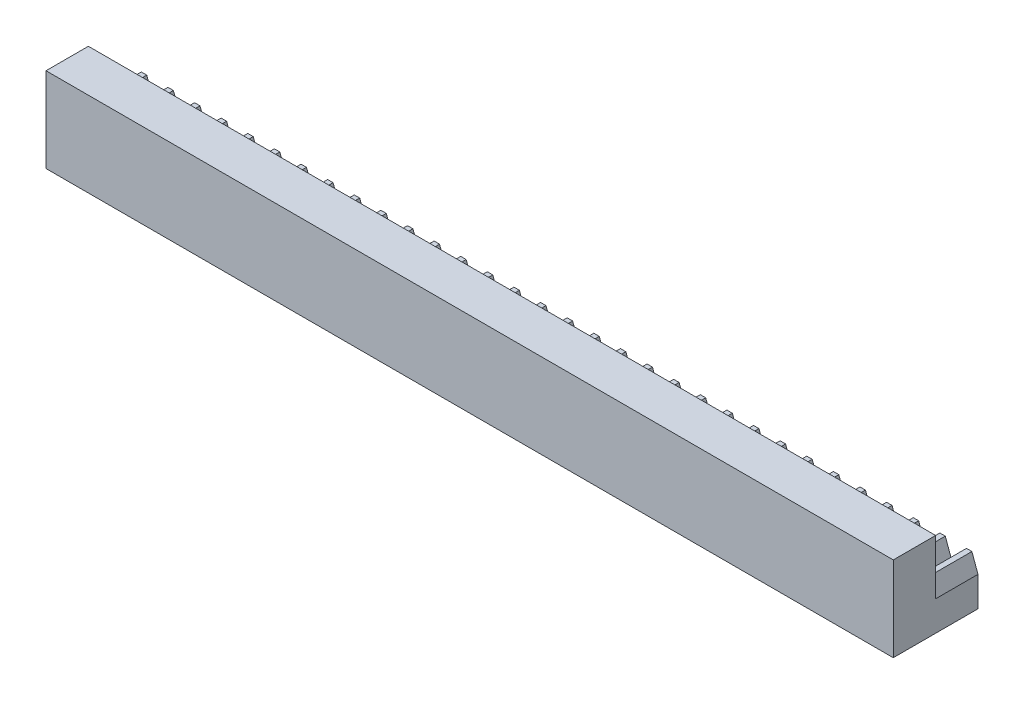
from build123d import *

# Parameters (mm, degrees)
BLANKSKE_W         = 200
BLANKSKE_H         = 11
BLANK_DEPTH        = 10
TOOTHCUTSIM_DEPTH  = 201.55173896
TEETHCUTS_COUNT    = 33
TEETHCUTS_PITCH    = 6.2831853
ESQUISSE2_W        = 200
ESQUISSE2_H        = 20
BOSS_EXTRU_2_DEPTH = 10


with BuildPart() as part:
    # BlankSke → Blank (new body)
    with BuildSketch(Plane.XY):
        with Locations((100, 5.5)):
            Rectangle(BLANKSKE_W, BLANKSKE_H)
    extrude(amount=-BLANK_DEPTH)

    # TooCutSkeSim → ToothCutSim (cut, through all)
    with BuildSketch(Plane.XY):
        Polygon((0.861870739, 6.5), (-0.861870739, 6.5), (-2.508981637, 11.0254), (2.508981637, 11.0254), align=None)
    toothcutsim = extrude(amount=-TOOTHCUTSIM_DEPTH, mode=Mode.SUBTRACT)

    # TeethCuts: ToothCutSim ×33
    with Locations(*[(i * TEETHCUTS_PITCH, 0, 0) for i in range(1, TEETHCUTS_COUNT)]):
        add(toothcutsim, mode=Mode.SUBTRACT)

    # Esquisse2 → Boss.-Extru.2 (add)
    with BuildSketch(Plane.XY):
        with Locations((100, 10)):
            Rectangle(ESQUISSE2_W, ESQUISSE2_H)
    extrude(amount=BOSS_EXTRU_2_DEPTH)


solid = part.part
